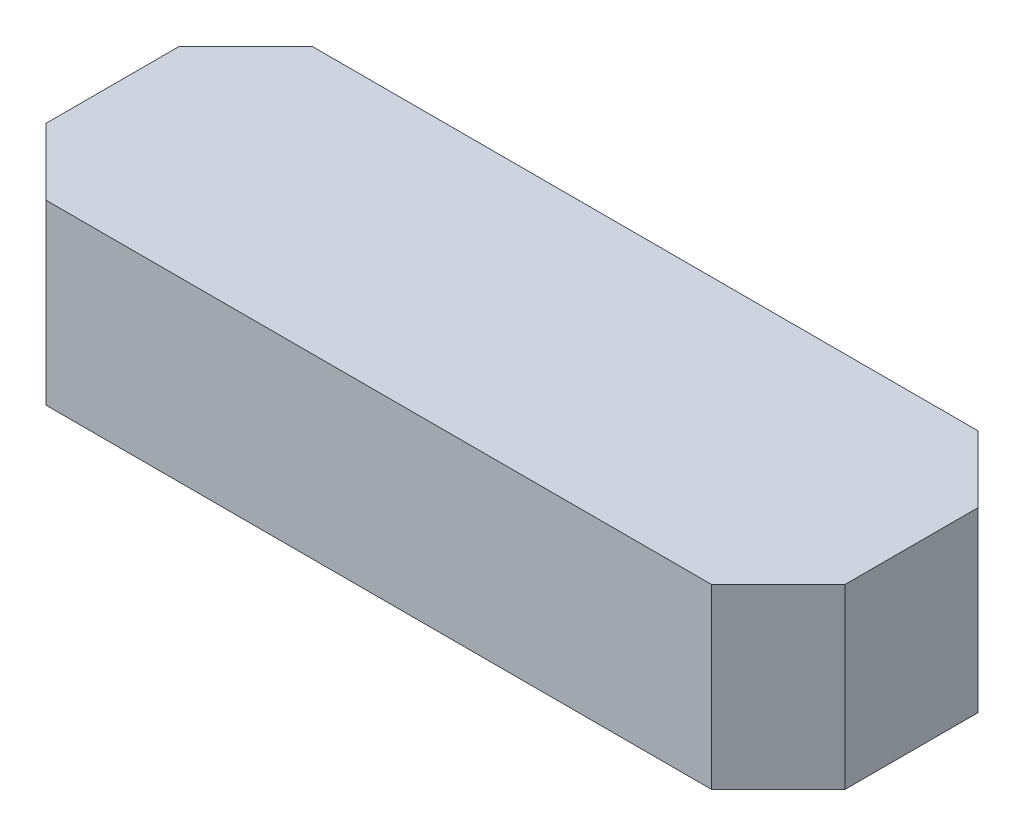
from build123d import *

# Parameters (mm, degrees)
SKETCH1_W           = 36
SKETCH1_H           = 12
SKETCH1_R           = 4
BOSS_EXTRUDE1_DEPTH = 5
SKETCH2_W           = 36
SKETCH2_H           = 12
BOSS_EXTRUDE2_DEPTH = 3
CHAMFER3_SIZE       = 3


with BuildPart() as part:
    # Sketch1 → Boss-Extrude1 (new body)
    with BuildSketch(Plane(origin=(0, 0, 0), x_dir=(1, 0, 0), z_dir=(0, 1, 0))):
        Rectangle(SKETCH1_W, SKETCH1_H)
        with Locations(Location((11.845, 0, 0), (0, 0, 270))):
            Circle(SKETCH1_R, mode=Mode.SUBTRACT)
        with Locations(Location((-11.845, 0, 0), (0, 0, 270))):
            Circle(SKETCH1_R, mode=Mode.SUBTRACT)
    extrude(amount=-BOSS_EXTRUDE1_DEPTH)

    # Sketch2 → Boss-Extrude2 (add)
    with BuildSketch(Plane(origin=(0, 0, 0), x_dir=(1, 0, 0), z_dir=(0, 1, 0))):
        Rectangle(SKETCH2_W, SKETCH2_H)
    extrude(amount=BOSS_EXTRUDE2_DEPTH)

    # Chamfer3
    chamfer3_edges = [part.edges().sort_by_distance(p)[0] for p in [
        (18, -1, 6),
        (-18, -1, 6),
        (-18, -1, -6),
        (18, -1, -6),
    ]]
    chamfer(chamfer3_edges, length=CHAMFER3_SIZE)


solid = part.part
